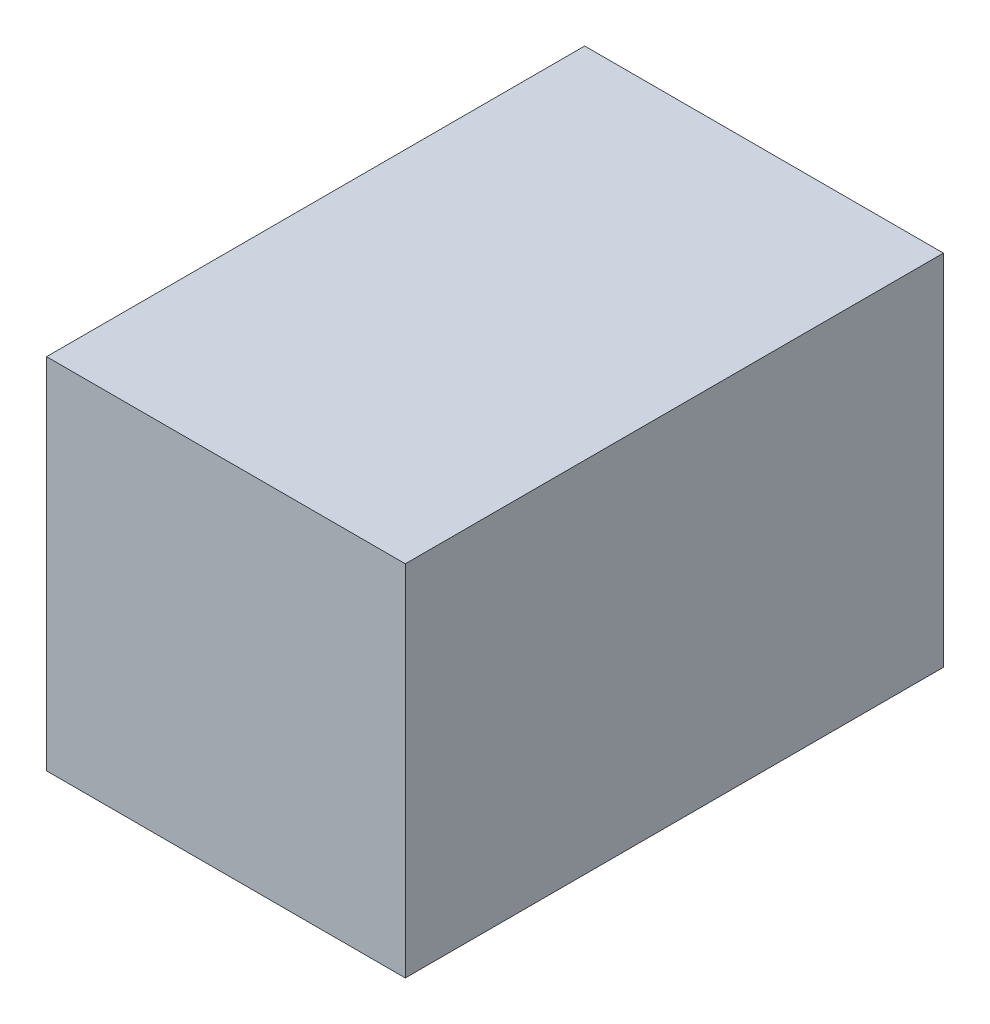
from build123d import *

# Parameters (mm, degrees)
SKIZZE1_W                       = 20
SKIZZE1_H                       = 20
AUFSATZ_LINEAR_AUSTRAGEN1_DEPTH = 30


with BuildPart() as part:
    # Skizze1 → Aufsatz-Linear austragen1 (new body)
    with BuildSketch(Plane.XY):
        Rectangle(SKIZZE1_W, SKIZZE1_H)
    extrude(amount=AUFSATZ_LINEAR_AUSTRAGEN1_DEPTH)


solid = part.part
